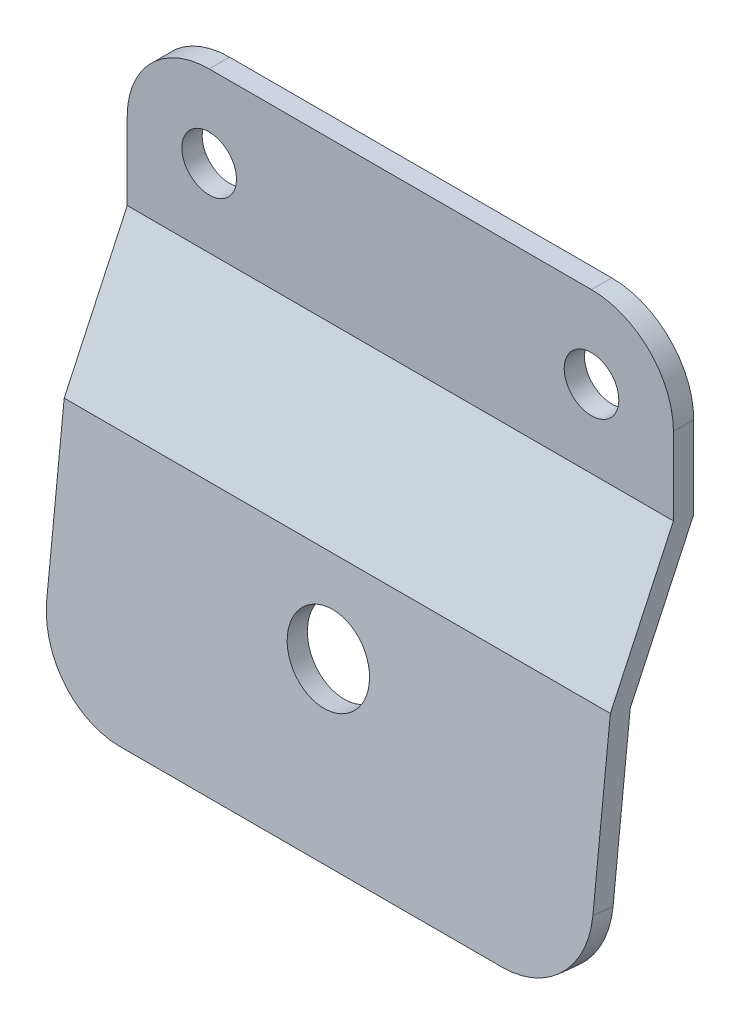
from build123d import *

# Parameters (mm, degrees)
EXTRUDE_THIN1_DEPTH     = 31.75
CUT_EXTRUDE1_DEPTH      = 79.232951004
CUT_EXTRUDE1_DEPTH_BACK = 79.232951004
SKETCH2_R               = 4.7625
SKETCH3_R               = 3.175
CUT_EXTRUDE2_DEPTH      = 56.93322439
FILLET1_R               = 9.525


with BuildPart() as part:
    # Sketch1 → Extrude-Thin1 (new, symmetric)
    with BuildSketch(Plane(origin=(0, 0, 0), x_dir=(0, 0, -1), z_dir=(1, 0, 0))):
        Polygon((0, 19.05), (0, 0), (-7.385338648, -15.83790984), (-10.372239485, -44.256373), (-12.721499107, -44.009455864), (-9.693278511, -15.19786147), (-2.3622, 0.523687132), (-2.3622, 19.05), align=None)
    extrude(amount=EXTRUDE_THIN1_DEPTH, both=True)

    # Sketch2 → Cut-Extrude1 (cut, two sides: drawn at the far end of the back side and taken through both)
    with BuildSketch(Plane(origin=(0, -51.169527341, 13.474052944), x_dir=(-1, 0, 0), z_dir=(0, 0.10452846326765357, 0.9945218953682734)).offset(-CUT_EXTRUDE1_DEPTH_BACK)):
        with Locations(Location((0, -26.249511152, 0), (0, 0, 270))):
            Circle(SKETCH2_R)
    extrude(amount=CUT_EXTRUDE1_DEPTH + CUT_EXTRUDE1_DEPTH_BACK, mode=Mode.SUBTRACT)

    # Sketch3 → Cut-Extrude2 (cut, through all)
    with BuildSketch(Plane(origin=(0, 0, 0), x_dir=(-1, 0, 0), z_dir=(0, 0, -1))):
        with Locations(Location((-22.225, 9.525, 0), (0, 0, 90))):
            Circle(SKETCH3_R)
        with Locations(Location((22.225, 9.525, 0), (0, 0, 90))):
            Circle(SKETCH3_R)
    extrude(amount=-CUT_EXTRUDE2_DEPTH, mode=Mode.SUBTRACT)

    # Fillet1
    fillet1_edges = [part.edges().sort_by_distance(p)[0] for p in [
        (31.75, 19.05, 1.1811),
        (-31.75, 19.05, 1.1811),
        (31.75, -44.132914432, 11.546869296),
        (-31.75, -44.132914432, 11.546869296),
    ]]
    fillet(fillet1_edges, radius=FILLET1_R)


solid = part.part
